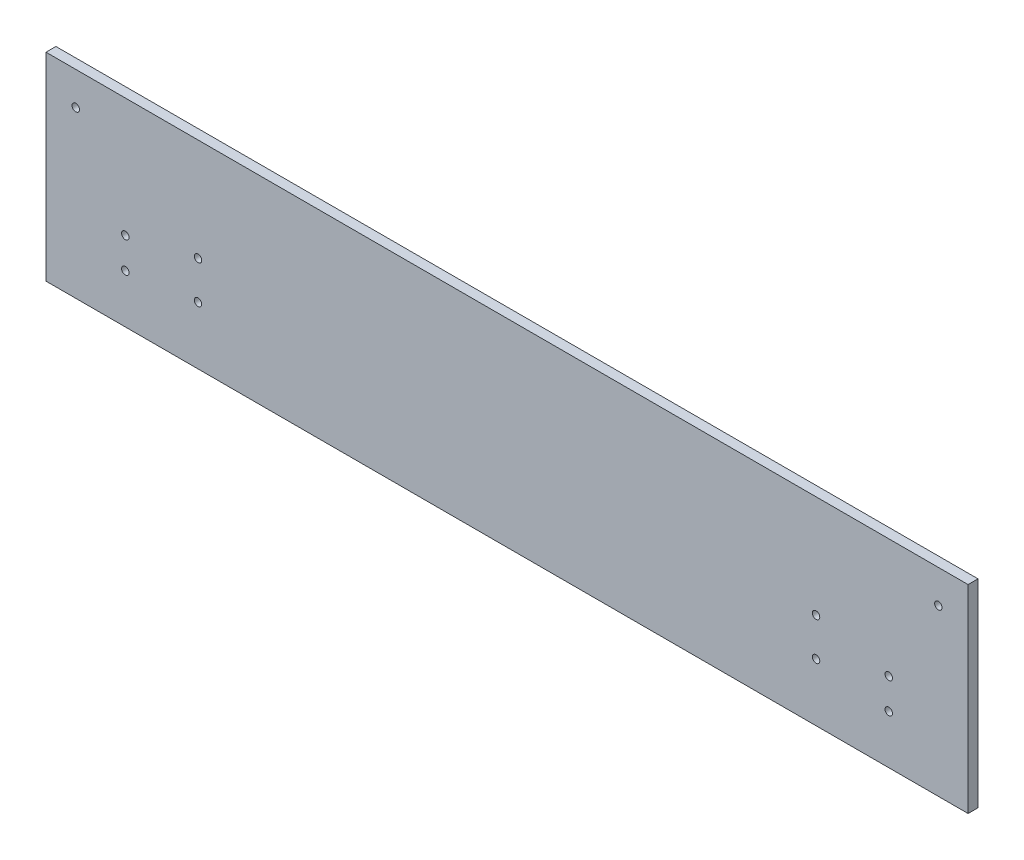
from build123d import *

# Parameters (mm, degrees)
SCHIZZO1_W                   = 558
SCHIZZO1_H                   = 120
ESTRUSIONE_ESTRUSIONE1_DEPTH = 6
SCHIZZO2_R                   = 2.25
TAGLIO_ESTRUSIONE1_DEPTH     = 10


with BuildPart() as part:
    # Schizzo1 → Estrusione-Estrusione1 (new body)
    with BuildSketch(Plane.XY):
        Rectangle(SCHIZZO1_W, SCHIZZO1_H)
    extrude(amount=ESTRUSIONE_ESTRUSIONE1_DEPTH)

    # Schizzo2 → Taglio-Estrusione1 (cut)
    with BuildSketch(Plane.XY.offset(6)):
        with Locations((-231, -12)):
            Circle(SCHIZZO2_R)
        with Locations((-231, -30.5)):
            Circle(SCHIZZO2_R)
        with Locations((231, -12)):
            Circle(SCHIZZO2_R)
        with Locations((231, -30.5)):
            Circle(SCHIZZO2_R)
        with Locations((-261, 40)):
            Circle(SCHIZZO2_R)
        with Locations((261, 40)):
            Circle(SCHIZZO2_R)
        with Locations((187, -25)):
            Circle(SCHIZZO2_R)
        with Locations((187, -2)):
            Circle(SCHIZZO2_R)
        with Locations((-187, -2)):
            Circle(SCHIZZO2_R)
        with Locations((-187, -25)):
            Circle(SCHIZZO2_R)
    extrude(amount=-TAGLIO_ESTRUSIONE1_DEPTH, mode=Mode.SUBTRACT)


solid = part.part
